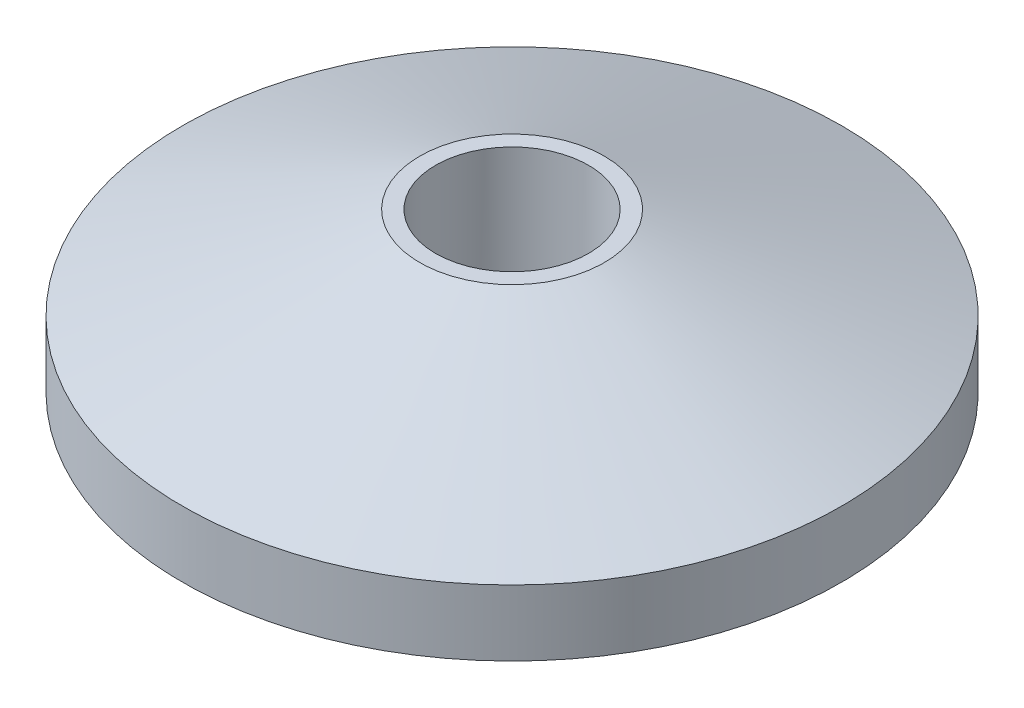
from build123d import *

# Parameters (mm, degrees)
SKETCH2_R          = 2.9
CUT_EXTRUDE1_DEPTH = 5


with BuildPart() as part:
    # Sketch1 → Revolve1 (revolve)
    with BuildSketch(Plane(origin=(0, 0, 0), x_dir=(0, 0, -1), z_dir=(1, 0, 0))):
        Polygon((0, 0), (12.5, 0), (12.5, 2.5), (3.5, 6), (0, 6), align=None)
    revolve(axis=Axis((0, 6, 0), (0, 1, 0)))

    # Sketch2 → Cut-Extrude1 (cut)
    with BuildSketch(Plane(origin=(0, 6, 0), x_dir=(1, 0, 0), z_dir=(0, 1, 0))):
        with Locations(Location((0, 0, 0), (0, 0, 270))):
            Circle(SKETCH2_R)
    extrude(amount=-CUT_EXTRUDE1_DEPTH, mode=Mode.SUBTRACT)


solid = part.part
